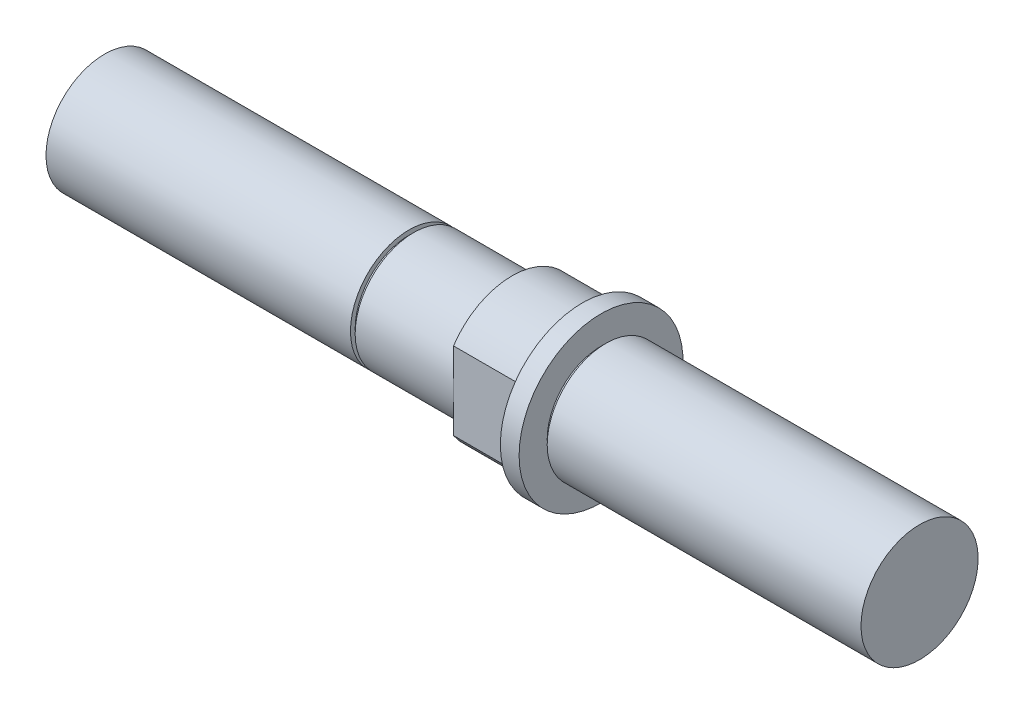
from build123d import *

# Parameters (mm, degrees)
SKETCH4_W          = 1
SKETCH4_H          = 1
SKETCH5_OUTSIDE_W  = 73.18
SKETCH5_OUTSIDE_H  = 73.18
CUT_EXTRUDE1_DEPTH = 15


with BuildPart() as part:
    # Sketch3 → Revolve2 (revolve)
    with BuildSketch(Plane.XY, mode=Mode.PRIVATE) as revolve2_sk:
        Polygon((0, 0), (0, 12.5), (-68, 12.5), (-68, 17.5), (-72, 17.5), (-72, 15), (-87, 15), (-87, 12.5), (-174, 12.5), (-174, 0), align=None)
    revolve(revolve2_sk.sketch.rotate(Axis((-174, 0, 0), (1, 0, 0)), 90), axis=Axis((-174, 0, 0), (1, 0, 0)))

    # Sketch4 → Cut-Revolve1 (revolve, cut)
    with BuildSketch(Plane.XY, mode=Mode.PRIVATE) as cut_revolve1_sk:
        with Locations((-108.5, 12)):
            Rectangle(SKETCH4_W, SKETCH4_H)
        with Locations((-67.5, 12)):
            Rectangle(SKETCH4_W, SKETCH4_H)
    revolve(cut_revolve1_sk.sketch.rotate(Axis((-174, 0, 0), (1, 0, 0)), 90), axis=Axis((-174, 0, 0), (1, 0, 0)), mode=Mode.SUBTRACT)

    # Sketch5 outside → Cut-Extrude1 (cut)
    with BuildSketch(Plane.ZY.offset(87)):
        Rectangle(SKETCH5_OUTSIDE_W, SKETCH5_OUTSIDE_H)
        with BuildLine():
            Line((-12.5, 8.291561976), (-12.5, -8.291561976))
            ThreePointArc((-12.5, -8.291561976), (0, -15), (12.5, -8.291561976))
            Line((12.5, -8.291561976), (12.5, 8.291561976))
            ThreePointArc((12.5, 8.291561976), (0, 15), (-12.5, 8.291561976))
        make_face(mode=Mode.SUBTRACT)
    extrude(amount=-CUT_EXTRUDE1_DEPTH, mode=Mode.SUBTRACT)


solid = part.part
